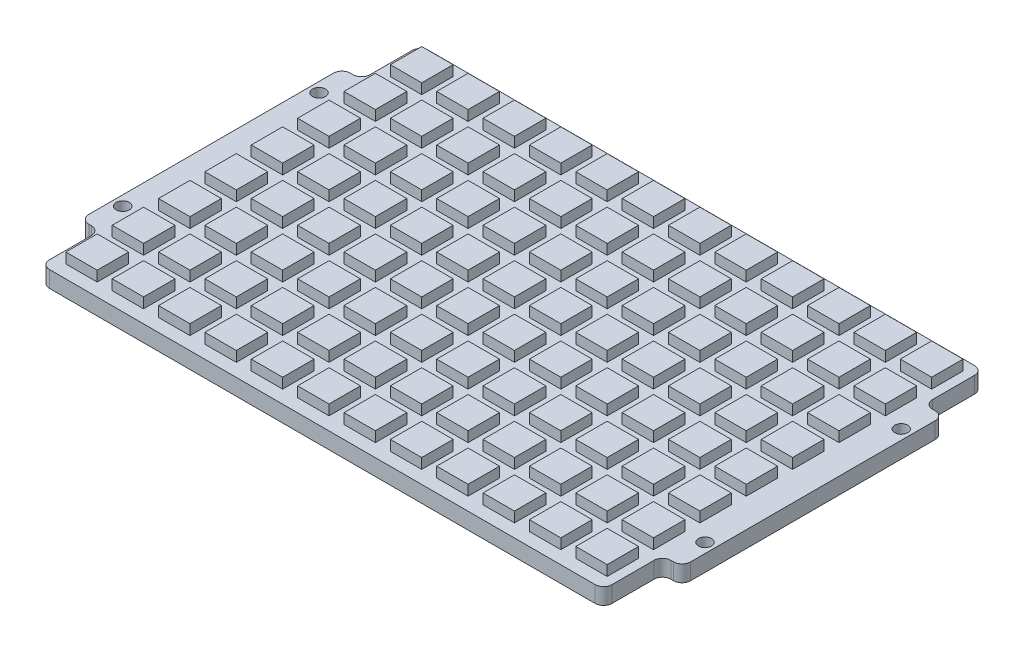
from build123d import *

# Parameters (mm, degrees)
SKETCH1_W            = 109.22
SKETCH1_H            = 73.66
BOSS_EXTRUDE1_DEPTH  = 3.175
BOSS_EXTRUDE3_DEPTH  = 3.048
LPATTERN1_COUNT      = 12
LPATTERN1_PITCH      = 9.000000034
LPATTERN1_COUNT_DIR2 = 8
LPATTERN1_PITCH_DIR2 = 9.000000034
SKETCH3_W            = 3.81
SKETCH3_H            = 50.8
SKETCH3_R            = 1.27
BOSS_EXTRUDE2_DEPTH  = 3.175
FILLET1_R            = 1.651


with BuildPart() as part:
    # Sketch1 → Boss-Extrude1 (new body)
    with BuildSketch(Plane(origin=(0, 0, 0), x_dir=(1, 0, 0), z_dir=(0, 1, 0))):
        Rectangle(SKETCH1_W, SKETCH1_H)
    extrude(amount=-BOSS_EXTRUDE1_DEPTH)

    # Sketch2 → Boss-Extrude3 (add, symmetric)
    with BuildSketch(Plane.XY.offset(-31.75)):
        Polygon((-49.276, 0), (-52.324, 0), (-52.324, 2), (-49.276, 2), (-46.228, 2), (-46.228, 0), align=None)
    boss_extrude3 = extrude(amount=BOSS_EXTRUDE3_DEPTH, both=True)

    # LPattern1: Boss-Extrude3 12 × 8
    with Locations(*[(i * LPATTERN1_PITCH, 0, j * LPATTERN1_PITCH_DIR2) for i in range(LPATTERN1_COUNT) for j in range(LPATTERN1_COUNT_DIR2) if (i, j) != (0, 0)]):
        add(boss_extrude3)

    # Sketch3 → Boss-Extrude2 (add)
    # profile 1 of 2: a face of its own
    with BuildSketch(Plane(origin=(0, 0, 0), x_dir=(1, 0, 0), z_dir=(0, 1, 0))):
        with Locations((-56.515, 0)):
            Rectangle(SKETCH3_W, SKETCH3_H)
        with Locations(Location((-56.515, 19.05, 0), (0, 0, 270))):
            Circle(SKETCH3_R, mode=Mode.SUBTRACT)
        with Locations(Location((-56.515, -19.05, 0), (0, 0, 270))):
            Circle(SKETCH3_R, mode=Mode.SUBTRACT)
    # profile 2 of 2: a face of its own
    with BuildSketch(Plane(origin=(0, 0, 0), x_dir=(1, 0, 0), z_dir=(0, 1, 0))):
        with Locations((56.515, 0)):
            Rectangle(SKETCH3_W, SKETCH3_H)
        with Locations(Location((56.515, -19.05, 0), (0, 0, 90))):
            Circle(SKETCH3_R, mode=Mode.SUBTRACT)
        with Locations(Location((56.515, 19.05, 0), (0, 0, 90))):
            Circle(SKETCH3_R, mode=Mode.SUBTRACT)
    extrude(amount=-BOSS_EXTRUDE2_DEPTH)

    # Fillet1
    fillet1_edges = [part.edges().sort_by_distance(p)[0] for p in [
        (-54.61, -1.5875, -25.4),
        (-54.61, -1.5875, 25.4),
        (-58.42, -1.5875, 25.4),
        (-58.42, -1.5875, -25.4),
        (54.61, -1.5875, -25.4),
        (58.42, -1.5875, -25.4),
        (58.42, -1.5875, 25.4),
        (54.61, -1.5875, 25.4),
        (54.61, -1.5875, 36.83),
        (-54.61, -1.5875, 36.83),
        (-54.61, -1.5875, -36.83),
        (54.61, -1.5875, -36.83),
    ]]
    fillet(fillet1_edges, radius=FILLET1_R)


solid = part.part
